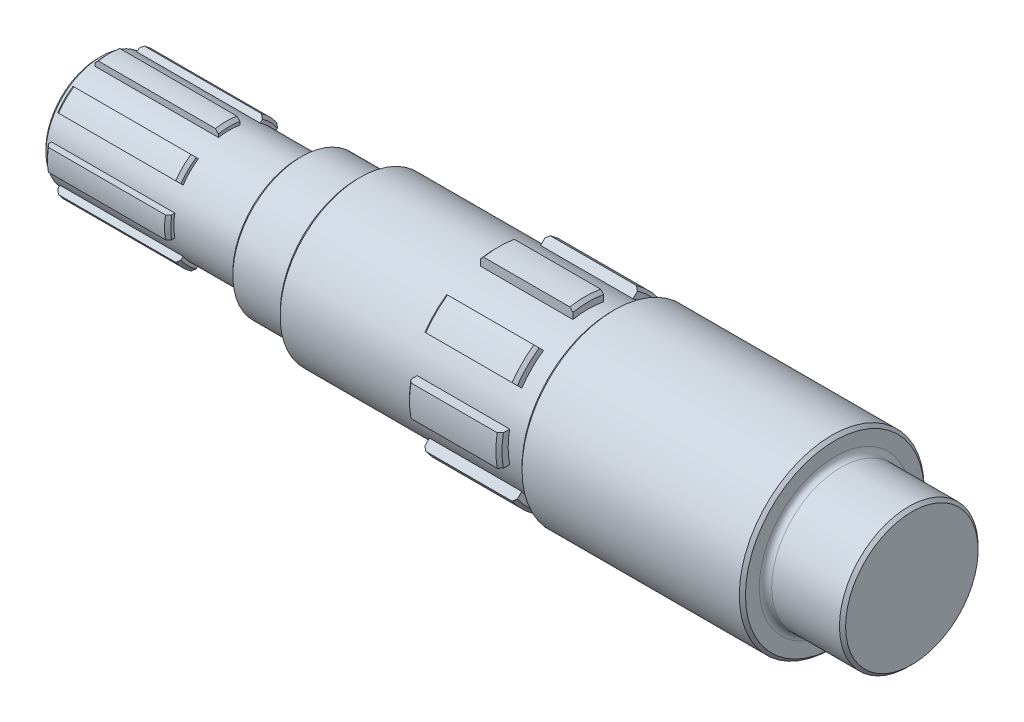
from build123d import *
from build123d.topology import SkipClean

# Parameters (mm, degrees)
CHAMFER1_SIZE      = 1
CUT_EXTRUDE1_REACH = 266.919
CUT_EXTRUDE2_REACH = 143.51
FILLET1_R          = 2


with BuildPart() as part:
    # Sketch1 → Revolve1 (revolve)
    with BuildSketch(Plane.XY, mode=Mode.PRIVATE) as revolve1_sk:
        Polygon((-90.956521739, 18), (-90.956521739, 22.347826087), (-71.956521739, 22.347826087), (-71.956521739, 26), (-26.956521739, 26), (-26.956521739, 29), (3.043478261, 29), (3.043478261, 26), (10.543478261, 26), (10.543478261, 30), (83.043478261, 30), (83.043478261, 22.5), (108.043478261, 22.5), (108.043478261, 0), (-155.956521739, 0), (-155.956521739, 18), (-153.456521739, 18), (-153.456521739, 20), (-113.456521739, 20), (-113.456521739, 18), align=None)
    revolve(revolve1_sk.sketch.rotate(Axis((-155.956521739, 0, 0), (1, 0, 0)), 90), axis=Axis((-155.956521739, 0, 0), (1, 0, 0)))

    # Chamfer1
    chamfer1_edges = [part.edges().sort_by_distance(p)[0] for p in [
        (108.043478261, 0, -22.5),
        (83.043478261, 0, -30),
        (10.543478261, 0, -30),
        (3.043478261, 0, -29),
        (-26.956521739, 0, -29),
        (-71.956521739, 0, -26),
        (-90.956521739, 0, -22.347826087),
        (-113.456521739, 0, -20),
        (-153.456521739, 0, -20),
        (-155.956521739, 0, -18),
    ]]
    chamfer(chamfer1_edges, length=CHAMFER1_SIZE)

    # Cut-Extrude1: up to this face of the body (flat: up to its plane)
    cut_extrude1_end = Plane(part.part.faces().sort_by_distance((-113.456521739, 0, -18.462598846))[0])
    # Sketch2 → Cut-Extrude1 (cut, up to the picked face)
    with BuildSketch(Plane.ZY.offset(153.456521739), mode=Mode.PRIVATE) as cut_extrude1_sk1:
        with BuildLine():
            Line((-3.5, 19.691368668), (-3.5, 17.656443583))
            ThreePointArc((-3.5, 17.656443583), (-6.888301783, 16.629831585), (-10.010117255, 14.959864723))
            Line((-10.010117255, 14.959864723), (-11.449026581, 16.39877405))
            ThreePointArc((-11.449026581, 16.39877405), (-7.653668647, 18.47759065), (-3.5, 19.691368668))
        make_face()
    cut_extrude1_tool1 = split(extrude(cut_extrude1_sk1.sketch, amount=-CUT_EXTRUDE1_REACH, mode=Mode.PRIVATE), bisect_by=cut_extrude1_end, keep=Keep.BOTH, mode=Mode.PRIVATE)
    # Sketch2 → Cut-Extrude1 (cut, up to the picked face)
    with BuildSketch(Plane.ZY.offset(153.456521739), mode=Mode.PRIVATE) as cut_extrude1_sk2:
        with BuildLine():
            Line((3.5, 19.691368668), (3.5, 17.656443583))
            ThreePointArc((3.5, 17.656443583), (6.888301783, 16.629831585), (10.010117255, 14.959864723))
            Line((10.010117255, 14.959864723), (11.449026581, 16.39877405))
            ThreePointArc((11.449026581, 16.39877405), (7.653668647, 18.47759065), (3.5, 19.691368668))
        make_face()
    cut_extrude1_tool2 = split(extrude(cut_extrude1_sk2.sketch, amount=-CUT_EXTRUDE1_REACH, mode=Mode.PRIVATE), bisect_by=cut_extrude1_end, keep=Keep.BOTH, mode=Mode.PRIVATE)
    # Sketch2 → Cut-Extrude1 (cut, up to the picked face)
    with BuildSketch(Plane.ZY.offset(153.456521739), mode=Mode.PRIVATE) as cut_extrude1_sk3:
        with BuildLine():
            Line((16.39877405, 11.449026581), (14.959864723, 10.010117255))
            ThreePointArc((14.959864723, 10.010117255), (16.629831585, 6.888301783), (17.656443583, 3.5))
            Line((17.656443583, 3.5), (19.691368668, 3.5))
            ThreePointArc((19.691368668, 3.5), (18.47759065, 7.653668647), (16.39877405, 11.449026581))
        make_face()
    cut_extrude1_tool3 = split(extrude(cut_extrude1_sk3.sketch, amount=-CUT_EXTRUDE1_REACH, mode=Mode.PRIVATE), bisect_by=cut_extrude1_end, keep=Keep.BOTH, mode=Mode.PRIVATE)
    # Sketch2 → Cut-Extrude1 (cut, up to the picked face)
    with BuildSketch(Plane.ZY.offset(153.456521739), mode=Mode.PRIVATE) as cut_extrude1_sk4:
        with BuildLine():
            Line((19.691368668, -3.5), (17.656443583, -3.5))
            ThreePointArc((17.656443583, -3.5), (16.629831585, -6.888301783), (14.959864723, -10.010117255))
            Line((14.959864723, -10.010117255), (16.39877405, -11.449026581))
            ThreePointArc((16.39877405, -11.449026581), (18.47759065, -7.653668647), (19.691368668, -3.5))
        make_face()
    cut_extrude1_tool4 = split(extrude(cut_extrude1_sk4.sketch, amount=-CUT_EXTRUDE1_REACH, mode=Mode.PRIVATE), bisect_by=cut_extrude1_end, keep=Keep.BOTH, mode=Mode.PRIVATE)
    # Sketch2 → Cut-Extrude1 (cut, up to the picked face)
    with BuildSketch(Plane.ZY.offset(153.456521739), mode=Mode.PRIVATE) as cut_extrude1_sk5:
        with BuildLine():
            Line((11.449026581, -16.39877405), (10.010117255, -14.959864723))
            ThreePointArc((10.010117255, -14.959864723), (6.888301783, -16.629831585), (3.5, -17.656443583))
            Line((3.5, -17.656443583), (3.5, -19.691368668))
            ThreePointArc((3.5, -19.691368668), (7.653668647, -18.47759065), (11.449026581, -16.39877405))
        make_face()
    cut_extrude1_tool5 = split(extrude(cut_extrude1_sk5.sketch, amount=-CUT_EXTRUDE1_REACH, mode=Mode.PRIVATE), bisect_by=cut_extrude1_end, keep=Keep.BOTH, mode=Mode.PRIVATE)
    # Sketch2 → Cut-Extrude1 (cut, up to the picked face)
    with BuildSketch(Plane.ZY.offset(153.456521739), mode=Mode.PRIVATE) as cut_extrude1_sk6:
        with BuildLine():
            Line((-3.5, -19.691368668), (-3.5, -17.656443583))
            ThreePointArc((-3.5, -17.656443583), (-6.888301783, -16.629831585), (-10.010117255, -14.959864723))
            Line((-10.010117255, -14.959864723), (-11.449026581, -16.39877405))
            ThreePointArc((-11.449026581, -16.39877405), (-7.653668647, -18.47759065), (-3.5, -19.691368668))
        make_face()
    cut_extrude1_tool6 = split(extrude(cut_extrude1_sk6.sketch, amount=-CUT_EXTRUDE1_REACH, mode=Mode.PRIVATE), bisect_by=cut_extrude1_end, keep=Keep.BOTH, mode=Mode.PRIVATE)
    # Sketch2 → Cut-Extrude1 (cut, up to the picked face)
    with BuildSketch(Plane.ZY.offset(153.456521739), mode=Mode.PRIVATE) as cut_extrude1_sk7:
        with BuildLine():
            Line((-16.39877405, -11.449026581), (-14.959864723, -10.010117255))
            ThreePointArc((-14.959864723, -10.010117255), (-16.629831585, -6.888301783), (-17.656443583, -3.5))
            Line((-17.656443583, -3.5), (-19.691368668, -3.5))
            ThreePointArc((-19.691368668, -3.5), (-18.47759065, -7.653668647), (-16.39877405, -11.449026581))
        make_face()
    cut_extrude1_tool7 = split(extrude(cut_extrude1_sk7.sketch, amount=-CUT_EXTRUDE1_REACH, mode=Mode.PRIVATE), bisect_by=cut_extrude1_end, keep=Keep.BOTH, mode=Mode.PRIVATE)
    # Sketch2 → Cut-Extrude1 (cut, up to the picked face)
    with BuildSketch(Plane.ZY.offset(153.456521739), mode=Mode.PRIVATE) as cut_extrude1_sk8:
        with BuildLine():
            Line((-19.691368668, 3.5), (-17.656443583, 3.5))
            ThreePointArc((-17.656443583, 3.5), (-16.629831585, 6.888301783), (-14.959864723, 10.010117255))
            Line((-14.959864723, 10.010117255), (-16.39877405, 11.449026581))
            ThreePointArc((-16.39877405, 11.449026581), (-18.47759065, 7.653668647), (-19.691368668, 3.5))
        make_face()
    cut_extrude1_tool8 = split(extrude(cut_extrude1_sk8.sketch, amount=-CUT_EXTRUDE1_REACH, mode=Mode.PRIVATE), bisect_by=cut_extrude1_end, keep=Keep.BOTH, mode=Mode.PRIVATE)
    add(cut_extrude1_tool1.solids().sort_by(Axis((-153.456522, 17.458245, -7.231442), (1, 0, 0)))[0], mode=Mode.SUBTRACT)
    add(cut_extrude1_tool2.solids().sort_by(Axis((-153.456522, 17.458245, 7.231442), (1, 0, 0)))[0], mode=Mode.SUBTRACT)
    add(cut_extrude1_tool3.solids().sort_by(Axis((-153.456522, 7.231442, 17.458245), (1, 0, 0)))[0], mode=Mode.SUBTRACT)
    add(cut_extrude1_tool4.solids().sort_by(Axis((-153.456522, -7.231442, 17.458245), (1, 0, 0)))[0], mode=Mode.SUBTRACT)
    add(cut_extrude1_tool5.solids().sort_by(Axis((-153.456522, -17.458245, 7.231442), (1, 0, 0)))[0], mode=Mode.SUBTRACT)
    add(cut_extrude1_tool6.solids().sort_by(Axis((-153.456522, -17.458245, -7.231442), (1, 0, 0)))[0], mode=Mode.SUBTRACT)
    add(cut_extrude1_tool7.solids().sort_by(Axis((-153.456522, -7.231442, -17.458245), (1, 0, 0)))[0], mode=Mode.SUBTRACT)
    add(cut_extrude1_tool8.solids().sort_by(Axis((-153.456522, 7.231442, -17.458245), (1, 0, 0)))[0], mode=Mode.SUBTRACT)

    # Cut-Extrude2: up to this face of the body (flat: up to its plane)
    cut_extrude2_end = Plane(part.part.faces().sort_by_distance((3.043478261, 0, -27.208040405))[0])
    # Sketch3 → Cut-Extrude2 (cut, up to the picked face)
    with BuildSketch(Plane.ZY.offset(26.956521739), mode=Mode.PRIVATE) as cut_extrude2_sk1:
        with BuildLine():
            Line((-5, 28.565713714), (-5, 25.514701644))
            ThreePointArc((-5, 25.514701644), (-9.949769241, 24.020867845), (-14.506084647, 21.577152459))
            Line((-14.506084647, 21.577152459), (-16.663475971, 23.734543783))
            ThreePointArc((-16.663475971, 23.734543783), (-11.097819539, 26.792506443), (-5, 28.565713714))
        make_face()
    cut_extrude2_tool1 = split(extrude(cut_extrude2_sk1.sketch, amount=-CUT_EXTRUDE2_REACH, mode=Mode.PRIVATE), bisect_by=cut_extrude2_end, keep=Keep.BOTH, mode=Mode.PRIVATE)
    # Sketch3 → Cut-Extrude2 (cut, up to the picked face)
    with BuildSketch(Plane.ZY.offset(26.956521739), mode=Mode.PRIVATE) as cut_extrude2_sk2:
        with BuildLine():
            Line((5, 28.565713714), (5, 25.514701644))
            ThreePointArc((5, 25.514701644), (9.949769241, 24.020867845), (14.506084647, 21.577152459))
            Line((14.506084647, 21.577152459), (16.663475971, 23.734543783))
            ThreePointArc((16.663475971, 23.734543783), (11.097819539, 26.792506443), (5, 28.565713714))
        make_face()
    cut_extrude2_tool2 = split(extrude(cut_extrude2_sk2.sketch, amount=-CUT_EXTRUDE2_REACH, mode=Mode.PRIVATE), bisect_by=cut_extrude2_end, keep=Keep.BOTH, mode=Mode.PRIVATE)
    # Sketch3 → Cut-Extrude2 (cut, up to the picked face)
    with BuildSketch(Plane.ZY.offset(26.956521739), mode=Mode.PRIVATE) as cut_extrude2_sk3:
        with BuildLine():
            Line((23.734543783, 16.663475971), (21.577152459, 14.506084647))
            ThreePointArc((21.577152459, 14.506084647), (24.020867845, 9.949769241), (25.514701644, 5))
            Line((25.514701644, 5), (28.565713714, 5))
            ThreePointArc((28.565713714, 5), (26.792506443, 11.097819539), (23.734543783, 16.663475971))
        make_face()
    cut_extrude2_tool3 = split(extrude(cut_extrude2_sk3.sketch, amount=-CUT_EXTRUDE2_REACH, mode=Mode.PRIVATE), bisect_by=cut_extrude2_end, keep=Keep.BOTH, mode=Mode.PRIVATE)
    # Sketch3 → Cut-Extrude2 (cut, up to the picked face)
    with BuildSketch(Plane.ZY.offset(26.956521739), mode=Mode.PRIVATE) as cut_extrude2_sk4:
        with BuildLine():
            Line((28.565713714, -5), (25.514701644, -5))
            ThreePointArc((25.514701644, -5), (24.020867845, -9.949769241), (21.577152459, -14.506084647))
            Line((21.577152459, -14.506084647), (23.734543783, -16.663475971))
            ThreePointArc((23.734543783, -16.663475971), (26.792506443, -11.097819539), (28.565713714, -5))
        make_face()
    cut_extrude2_tool4 = split(extrude(cut_extrude2_sk4.sketch, amount=-CUT_EXTRUDE2_REACH, mode=Mode.PRIVATE), bisect_by=cut_extrude2_end, keep=Keep.BOTH, mode=Mode.PRIVATE)
    # Sketch3 → Cut-Extrude2 (cut, up to the picked face)
    with BuildSketch(Plane.ZY.offset(26.956521739), mode=Mode.PRIVATE) as cut_extrude2_sk5:
        with BuildLine():
            Line((16.663475971, -23.734543783), (14.506084647, -21.577152459))
            ThreePointArc((14.506084647, -21.577152459), (9.949769241, -24.020867845), (5, -25.514701644))
            Line((5, -25.514701644), (5, -28.565713714))
            ThreePointArc((5, -28.565713714), (11.097819539, -26.792506443), (16.663475971, -23.734543783))
        make_face()
    cut_extrude2_tool5 = split(extrude(cut_extrude2_sk5.sketch, amount=-CUT_EXTRUDE2_REACH, mode=Mode.PRIVATE), bisect_by=cut_extrude2_end, keep=Keep.BOTH, mode=Mode.PRIVATE)
    # Sketch3 → Cut-Extrude2 (cut, up to the picked face)
    with BuildSketch(Plane.ZY.offset(26.956521739), mode=Mode.PRIVATE) as cut_extrude2_sk6:
        with BuildLine():
            Line((-5, -28.565713714), (-5, -25.514701644))
            ThreePointArc((-5, -25.514701644), (-9.949769241, -24.020867845), (-14.506084647, -21.577152459))
            Line((-14.506084647, -21.577152459), (-16.663475971, -23.734543783))
            ThreePointArc((-16.663475971, -23.734543783), (-11.097819539, -26.792506443), (-5, -28.565713714))
        make_face()
    cut_extrude2_tool6 = split(extrude(cut_extrude2_sk6.sketch, amount=-CUT_EXTRUDE2_REACH, mode=Mode.PRIVATE), bisect_by=cut_extrude2_end, keep=Keep.BOTH, mode=Mode.PRIVATE)
    # Sketch3 → Cut-Extrude2 (cut, up to the picked face)
    with BuildSketch(Plane.ZY.offset(26.956521739), mode=Mode.PRIVATE) as cut_extrude2_sk7:
        with BuildLine():
            Line((-23.734543783, -16.663475971), (-21.577152459, -14.506084647))
            ThreePointArc((-21.577152459, -14.506084647), (-24.020867845, -9.949769241), (-25.514701644, -5))
            Line((-25.514701644, -5), (-28.565713714, -5))
            ThreePointArc((-28.565713714, -5), (-26.792506443, -11.097819539), (-23.734543783, -16.663475971))
        make_face()
    cut_extrude2_tool7 = split(extrude(cut_extrude2_sk7.sketch, amount=-CUT_EXTRUDE2_REACH, mode=Mode.PRIVATE), bisect_by=cut_extrude2_end, keep=Keep.BOTH, mode=Mode.PRIVATE)
    # Sketch3 → Cut-Extrude2 (cut, up to the picked face)
    with BuildSketch(Plane.ZY.offset(26.956521739), mode=Mode.PRIVATE) as cut_extrude2_sk8:
        with BuildLine():
            Line((-28.565713714, 5), (-25.514701644, 5))
            ThreePointArc((-25.514701644, 5), (-24.020867845, 9.949769241), (-21.577152459, 14.506084647))
            Line((-21.577152459, 14.506084647), (-23.734543783, 16.663475971))
            ThreePointArc((-23.734543783, 16.663475971), (-26.792506443, 11.097819539), (-28.565713714, 5))
        make_face()
    cut_extrude2_tool8 = split(extrude(cut_extrude2_sk8.sketch, amount=-CUT_EXTRUDE2_REACH, mode=Mode.PRIVATE), bisect_by=cut_extrude2_end, keep=Keep.BOTH, mode=Mode.PRIVATE)
    add(cut_extrude2_tool1.solids().sort_by(Axis((-26.956522, 25.266905, -10.465895), (1, 0, 0)))[0], mode=Mode.SUBTRACT)
    add(cut_extrude2_tool2.solids().sort_by(Axis((-26.956522, 25.266905, 10.465895), (1, 0, 0)))[0], mode=Mode.SUBTRACT)
    add(cut_extrude2_tool3.solids().sort_by(Axis((-26.956522, 10.465895, 25.266905), (1, 0, 0)))[0], mode=Mode.SUBTRACT)
    add(cut_extrude2_tool4.solids().sort_by(Axis((-26.956522, -10.465895, 25.266905), (1, 0, 0)))[0], mode=Mode.SUBTRACT)
    add(cut_extrude2_tool5.solids().sort_by(Axis((-26.956522, -25.266905, 10.465895), (1, 0, 0)))[0], mode=Mode.SUBTRACT)
    add(cut_extrude2_tool6.solids().sort_by(Axis((-26.956522, -25.266905, -10.465895), (1, 0, 0)))[0], mode=Mode.SUBTRACT)
    add(cut_extrude2_tool7.solids().sort_by(Axis((-26.956522, -10.465895, -25.266905), (1, 0, 0)))[0], mode=Mode.SUBTRACT)
    add(cut_extrude2_tool8.solids().sort_by(Axis((-26.956522, 10.465895, -25.266905), (1, 0, 0)))[0], mode=Mode.SUBTRACT)

    # Fillet1
    fillet1_edges = [part.edges().sort_by_distance(p)[0] for p in [
        (83.043478261, 0, -22.5),
        (10.543478261, 0, -26),
        (-71.956521739, 0, -22.347826087),
        (-90.956521739, 0, -18),
    ]]
    fillet(fillet1_edges, radius=FILLET1_R)


solid = part.part
